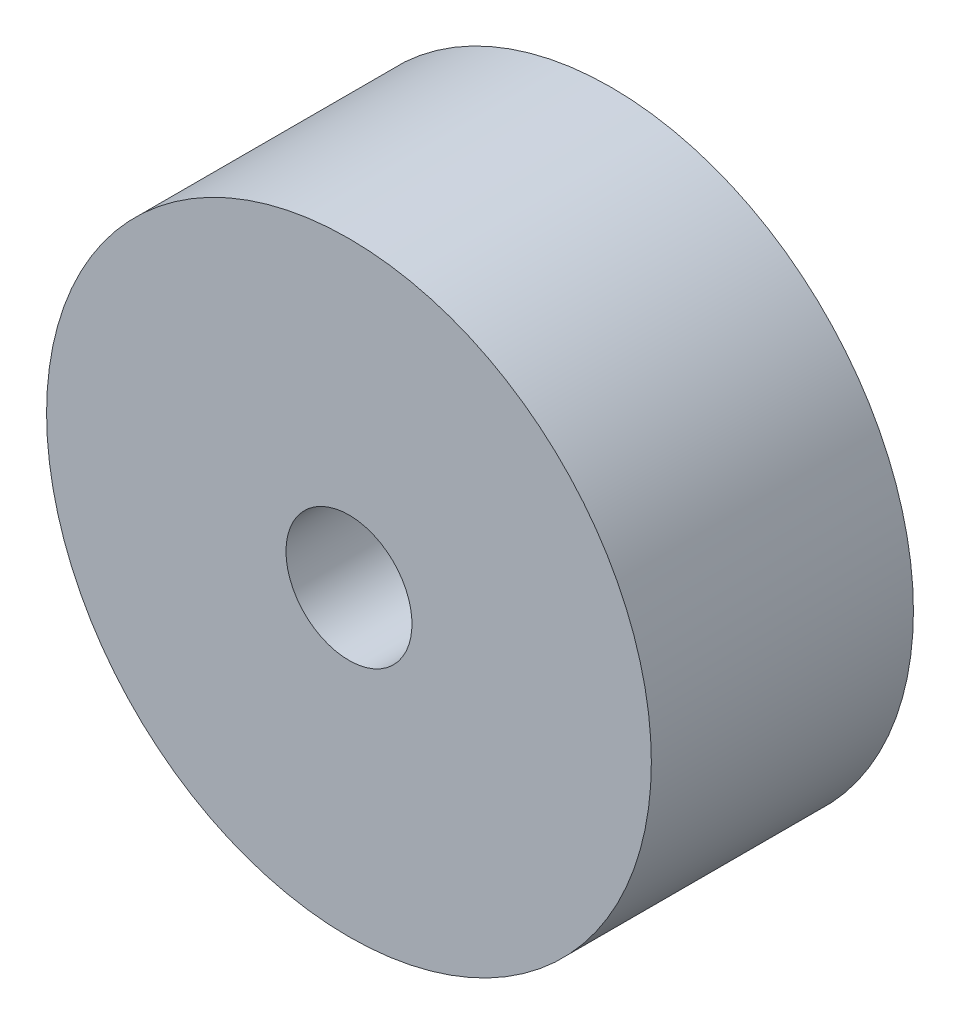
from build123d import *

# Parameters (mm, degrees)
SKETCH1_R           = 30
SKETCH1_R_2         = 6.25
BOSS_EXTRUDE1_DEPTH = 26


with BuildPart() as part:
    # Sketch1 → Boss-Extrude1 (new body)
    with BuildSketch(Plane.XY):
        with Locations(Location((0, 0, 0), (0, 0, 180))):
            Circle(SKETCH1_R)
        with Locations(Location((0, 0, 0), (0, 0, 180))):
            Circle(SKETCH1_R_2, mode=Mode.SUBTRACT)
    extrude(amount=BOSS_EXTRUDE1_DEPTH)


solid = part.part
